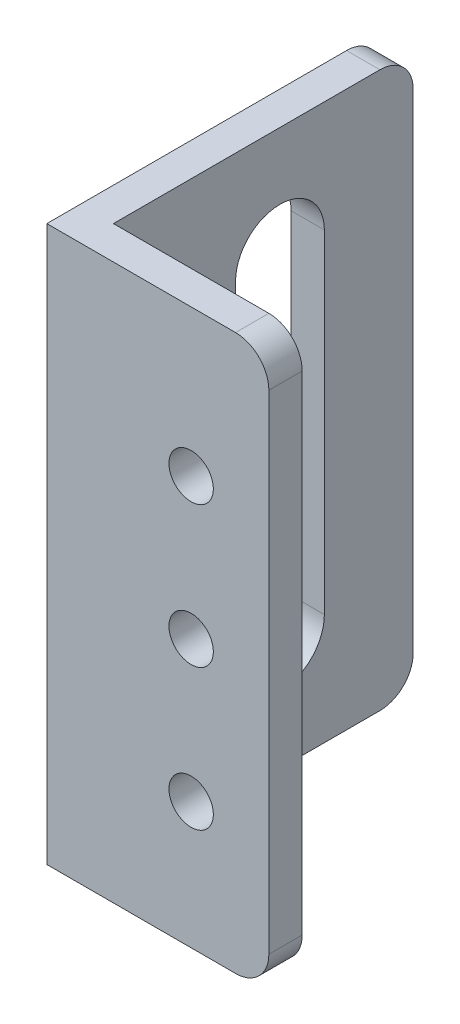
from build123d import *

# Parameters (mm, degrees)
SKETCH_1_W          = 3
SKETCH_1_H          = 27
SKETCH_1_H_2        = 3
SKETCH_1_W_2        = 17
EXTRUDE_1_DEPTH     = 50
SKETCH_2_R          = 2
CUT_EXTRUDE_1_DEPTH = 10
CUT_EXTRUDE_2_DEPTH = 10
FILLET_1_R          = 3


with BuildPart() as part:
    # 草图1 → 凸台-拉伸1 (new body)
    with BuildSketch(Plane(origin=(0, 0, 0), x_dir=(1, 0, 0), z_dir=(0, 1, 0))):
        with Locations((0, 1.5)):
            Rectangle(SKETCH_1_W, SKETCH_1_H)
        with Locations((0, -13.5)):
            Rectangle(SKETCH_1_W, SKETCH_1_H_2)
        with Locations((10, -13.5)):
            Rectangle(SKETCH_1_W_2, SKETCH_1_H_2)
    extrude(amount=EXTRUDE_1_DEPTH)

    # 草图2 → 切除-拉伸1 (cut)
    with BuildSketch(Plane.XY.offset(15)):
        with Locations((11.5, 36.8)):
            Circle(SKETCH_2_R)
        with Locations((11.5, 24.1)):
            Circle(SKETCH_2_R)
        with Locations((11.5, 11.4)):
            Circle(SKETCH_2_R)
    extrude(amount=-CUT_EXTRUDE_1_DEPTH, mode=Mode.SUBTRACT)

    # 草图3 → 切除-拉伸2 (cut)
    with BuildSketch(Plane.ZY.offset(1.5)):
        with BuildLine():
            Line((1, 40), (1, 10))
            ThreePointArc((1, 10), (-3, 6), (-7, 10))
            Line((-7, 10), (-7, 40))
            ThreePointArc((-7, 40), (-3, 44), (1, 40))
        make_face()
    extrude(amount=-CUT_EXTRUDE_2_DEPTH, mode=Mode.SUBTRACT)

    # 圆角1
    fillet_1_edges = [part.edges().sort_by_distance(p)[0] for p in [
        (18.5, 0, 13.5),
        (18.5, 50, 13.5),
        (0, 50, -15),
        (0, 0, -15),
    ]]
    fillet(fillet_1_edges, radius=FILLET_1_R)


solid = part.part
